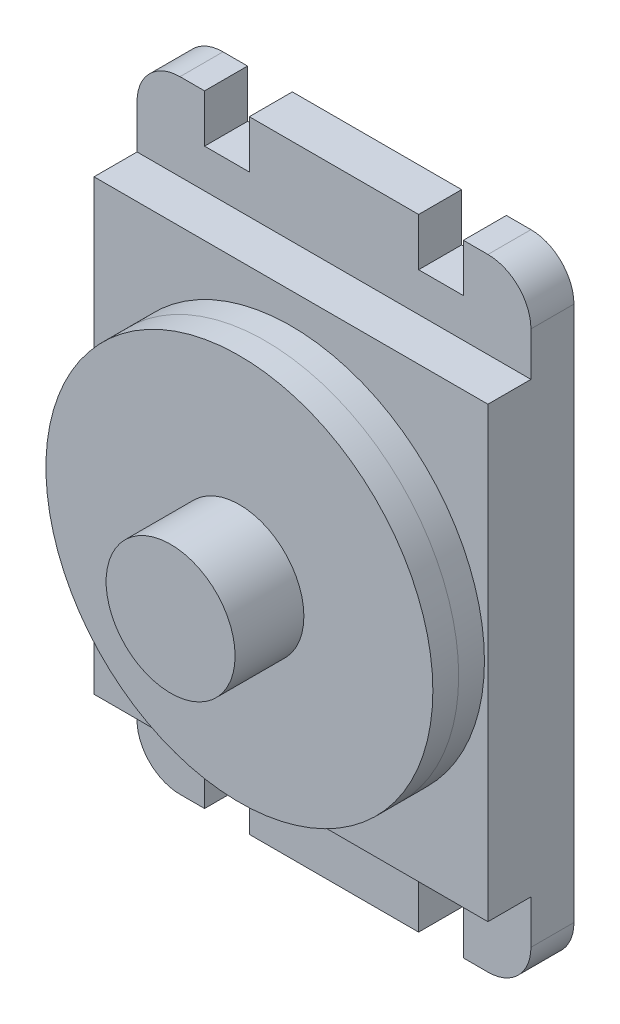
from build123d import *

# Parameters (mm, degrees)
BOSS_EXTRUDE1_DEPTH = 5
SKETCH2_W           = 45.810159344
SKETCH2_H           = 52.118901322
BOSS_EXTRUDE2_DEPTH = 5
SKETCH3_R           = 22.5
BOSS_EXTRUDE3_DEPTH = 3
SKETCH4_R           = 22.5
BOSS_EXTRUDE4_DEPTH = 3
SKETCH5_R           = 7.5
BOSS_EXTRUDE5_DEPTH = 8
SKETCH6_R           = 2.5
BOSS_EXTRUDE6_DEPTH = 5


with BuildPart() as part:
    # Sketch1 → Boss-Extrude1 (new body)
    with BuildSketch(Plane.XY):
        with BuildLine():
            Line((-70.048605571, 36.141662037), (-70.048605571, 30.571525081))
            Line((-70.048605571, 30.571525081), (-64.84517384, 30.571525081))
            Line((-64.84517384, 30.571525081), (-64.84517384, 36.141662037))
            Line((-64.84517384, 36.141662037), (-45.15482616, 36.141662037))
            Line((-45.15482616, 36.141662037), (-45.15482616, 30.571525081))
            Line((-45.15482616, 30.571525081), (-39.951394429, 30.571525081))
            Line((-39.951394429, 30.571525081), (-39.951394429, 36.141662037))
            Line((-39.951394429, 36.141662037), (-37.094920328, 36.141662037))
            ThreePointArc((-37.094920328, 36.141662037), (-33.559386422, 34.677195943), (-32.094920328, 31.141662037))
            Line((-32.094920328, 31.141662037), (-32.094920328, -31.141662037))
            ThreePointArc((-32.094920328, -31.141662037), (-33.559386422, -34.677195943), (-37.094920328, -36.141662037))
            Line((-37.094920328, -36.141662037), (-39.951394429, -36.141662037))
            Line((-39.951394429, -36.141662037), (-39.951394429, -30.571525081))
            Line((-39.951394429, -30.571525081), (-45.15482616, -30.571525081))
            Line((-45.15482616, -30.571525081), (-45.15482616, -36.141662037))
            Line((-45.15482616, -36.141662037), (-64.84517384, -36.141662037))
            Line((-64.84517384, -36.141662037), (-64.84517384, -30.571525081))
            Line((-64.84517384, -30.571525081), (-70.048605571, -30.571525081))
            Line((-70.048605571, -30.571525081), (-70.048605571, -36.141662037))
            Line((-70.048605571, -36.141662037), (-72.905079672, -36.141662037))
            ThreePointArc((-72.905079672, -36.141662037), (-76.440613578, -34.677195943), (-77.905079672, -31.141662037))
            Line((-77.905079672, -31.141662037), (-77.905079672, 31.141662037))
            ThreePointArc((-77.905079672, 31.141662037), (-76.440613578, 34.677195943), (-72.905079672, 36.141662037))
            Line((-72.905079672, 36.141662037), (-70.048605571, 36.141662037))
        make_face()
    extrude(amount=BOSS_EXTRUDE1_DEPTH)

    # Sketch2 → Boss-Extrude2 (add)
    with BuildSketch(Plane.XY.offset(5)):
        with Locations((-55, 0)):
            Rectangle(SKETCH2_W, SKETCH2_H)
    extrude(amount=BOSS_EXTRUDE2_DEPTH)

    # Sketch3 → Boss-Extrude3 (add)
    with BuildSketch(Plane.XY.offset(10)):
        with Locations((-55, 0)):
            Circle(SKETCH3_R)
    extrude(amount=BOSS_EXTRUDE3_DEPTH)

    # Sketch6 → Boss-Extrude6 (add)
    with BuildSketch(Plane(origin=(0, 0, 0), x_dir=(-1, 0, 0), z_dir=(0, 0, -1))):
        with Locations(Location((42.094920328, 16.141662037, 0), (0, 0, 180))):
            Circle(SKETCH6_R)
        with Locations(Location((67.905079672, -16.141662037, 0), (0, 0, 180))):
            Circle(SKETCH6_R)
    extrude(amount=BOSS_EXTRUDE6_DEPTH)


with BuildPart() as body_2:
    # Sketch4 → Boss-Extrude4 (new body)
    with BuildSketch(Plane.XY.offset(13)):
        with Locations((-55, 0)):
            Circle(SKETCH4_R)
    extrude(amount=BOSS_EXTRUDE4_DEPTH)

    # Sketch5 → Boss-Extrude5 (add)
    with BuildSketch(Plane.XY.offset(16)):
        with Locations((-55, 0)):
            Circle(SKETCH5_R)
    extrude(amount=BOSS_EXTRUDE5_DEPTH)


solid = Compound([part.part, body_2.part])
